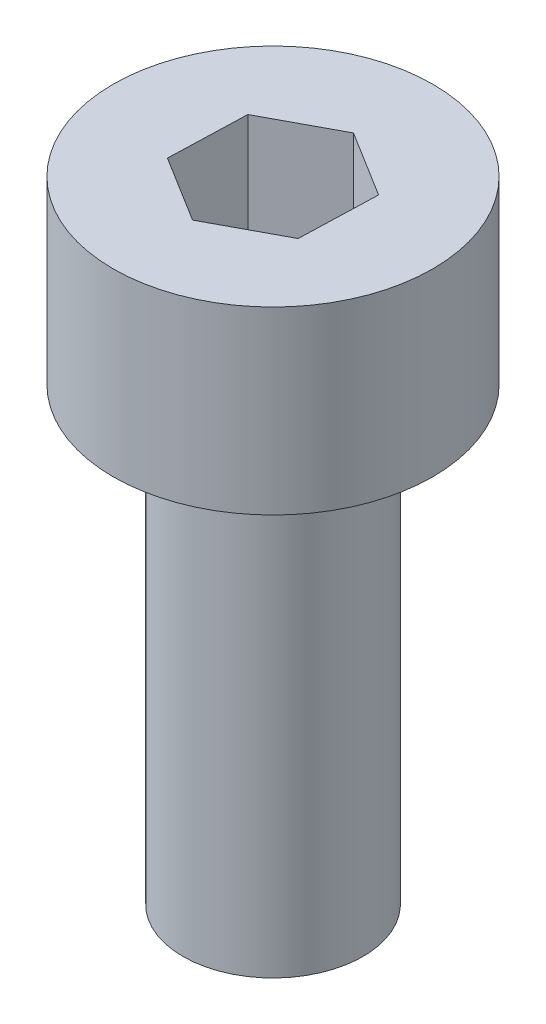
from build123d import *

# Parameters (mm, degrees)
SKETCH1_R           = 3.55
BOSS_EXTRUDE1_DEPTH = 4
SKETCH2_R           = 2
BOSS_EXTRUDE2_DEPTH = 10
CUT_EXTRUDE1_DEPTH  = 3


with BuildPart() as part:
    # Sketch1 → Boss-Extrude1 (new body)
    with BuildSketch(Plane(origin=(0, 0, 0), x_dir=(1, 0, 0), z_dir=(0, 1, 0))):
        with Locations(Location((0, 0, 0), (0, 0, 270))):
            Circle(SKETCH1_R)
    extrude(amount=BOSS_EXTRUDE1_DEPTH)

    # Sketch2 → Boss-Extrude2 (add)
    with BuildSketch(Plane.XZ):
        with Locations(Location((0, 0, 0), (0, 0, 270))):
            Circle(SKETCH2_R)
    extrude(amount=BOSS_EXTRUDE2_DEPTH)

    # Sketch3 → Cut-Extrude1 (cut)
    with BuildSketch(Plane(origin=(0, 4, 0), x_dir=(1, 0, 0), z_dir=(0, 1, 0))):
        Polygon((0.055152398, 1.731172497), (-1.471663161, 0.913349626), (-1.526815559, -0.81782287), (-0.055152398, -1.731172497), (1.471663161, -0.913349626), (1.526815559, 0.81782287), align=None)
    extrude(amount=-CUT_EXTRUDE1_DEPTH, mode=Mode.SUBTRACT)


solid = part.part
